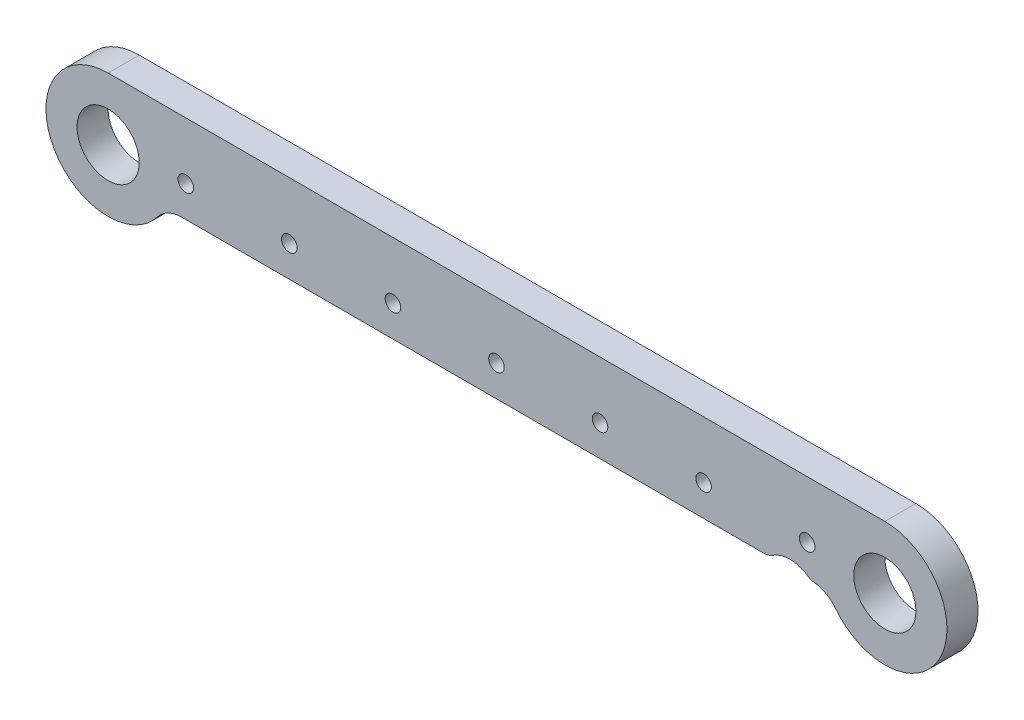
from build123d import *

# Parameters (mm, degrees)
SKETCH_1_R          = 6
EXTRUDE_1_DEPTH     = 6
CUT_EXTRUDE_START   = -6
CUT_EXTRUDE_1_DEPTH = 6
FILLET_1_R          = 6
SKETCH_6_R          = 1.5
CUT_EXTRUDE_2_DEPTH = 10
SKETCH_7_R          = 6
CUT_EXTRUDE_3_DEPTH = 10
FILLET_2_R          = 3


with BuildPart() as part:
    # 草图1 → 凸台-拉伸1 (new body)
    with BuildSketch(Plane.XY):
        with BuildLine():
            Line((0, 12), (150, 12))
            ThreePointArc((150, 12), (162, 0), (150, -12))
            Line((150, -12), (0, -12))
            ThreePointArc((0, -12), (-12, 0), (0, 12))
        make_face()
        Circle(SKETCH_1_R, mode=Mode.SUBTRACT)
        with Locations((150, 0)):
            Circle(SKETCH_1_R, mode=Mode.SUBTRACT)
    extrude(amount=EXTRUDE_1_DEPTH)

    # 草图2 → 切除-拉伸1 (cut)
    with BuildSketch(Plane.XY.offset(6).offset(CUT_EXTRUDE_START)):
        with BuildLine():
            ThreePointArc((10.908712115, -5), (6.480740698, -10.099504938), (0, -12))
            Line((0, -12), (150, -12))
            ThreePointArc((150, -12), (143.519259302, -10.099504938), (139.091287885, -5))
            Line((139.091287885, -5), (10.908712115, -5))
        make_face()
    extrude(amount=CUT_EXTRUDE_1_DEPTH, mode=Mode.SUBTRACT)

    # 圆角1
    fillet_1_edges = [part.edges().sort_by_distance(p)[0] for p in [
        (139.091287885, -5, 3),
        (10.908712115, -5, 3),
    ]]
    fillet(fillet_1_edges, radius=FILLET_1_R)

    # 草图6 → 切除-拉伸2 (cut)
    with BuildSketch(Plane.XY.offset(6)):
        with Locations((15, 1)):
            Circle(SKETCH_6_R)
        with Locations((35, 1)):
            Circle(SKETCH_6_R)
        with Locations((55, 1)):
            Circle(SKETCH_6_R)
        with Locations((75, 1)):
            Circle(SKETCH_6_R)
        with Locations((95, 1)):
            Circle(SKETCH_6_R)
        with Locations((115, 1)):
            Circle(SKETCH_6_R)
        with Locations((135, 1)):
            Circle(SKETCH_6_R)
    extrude(amount=-CUT_EXTRUDE_2_DEPTH, mode=Mode.SUBTRACT)

    # 草图7 → 切除-拉伸3 (cut)
    with BuildSketch(Plane(origin=(0, 0, 0), x_dir=(-1, 0, 0), z_dir=(0, 0, -1))):
        with Locations((-131.694159211, -9.484293539)):
            Circle(SKETCH_7_R)
    extrude(amount=-CUT_EXTRUDE_3_DEPTH, mode=Mode.SUBTRACT)

    # 圆角2
    fillet_2_edges = [part.edges().sort_by_distance(p)[0] for p in [
        (127.707793516, -5, 3),
        (135.680524907, -5, 3),
    ]]
    fillet(fillet_2_edges, radius=FILLET_2_R)


solid = part.part
